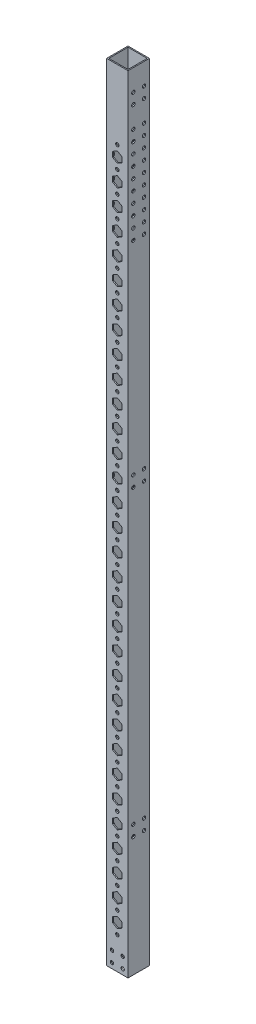
from build123d import *

# Parameters (mm, degrees)
SKETCH_1_W          = 20
SKETCH_1_H          = 20
SKETCH_1_W_2        = 18
SKETCH_1_H_2        = 18
EXTRUDE_1_DEPTH     = 735
SKETCH_4_R          = 1.6
CUT_EXTRUDE_2_DEPTH = 736.340057388
SKETCH_5_R          = 1.6
CUT_EXTRUDE_3_DEPTH = 736.340057388


with BuildPart() as part:
    # 草图1 → 拉伸-薄壁1 (new body)
    with BuildSketch(Plane(origin=(0, 0, 0), x_dir=(1, 0, 0), z_dir=(0, 1, 0))):
        Rectangle(SKETCH_1_W, SKETCH_1_H)
        Rectangle(SKETCH_1_W_2, SKETCH_1_H_2, mode=Mode.SUBTRACT)
    extrude(amount=EXTRUDE_1_DEPTH)

    # 草图4 → 切除-拉伸2 (cut, through all)
    with BuildSketch(Plane.XY.offset(10)):
        with Locations((0, 30)):
            Circle(SKETCH_4_R)
        with Locations((0, 50)):
            Circle(SKETCH_4_R)
        with Locations((0, 70)):
            Circle(SKETCH_4_R)
        with Locations((0, 90)):
            Circle(SKETCH_4_R)
        with Locations((0, 110)):
            Circle(SKETCH_4_R)
        with Locations((0, 130)):
            Circle(SKETCH_4_R)
        with Locations((0, 150)):
            Circle(SKETCH_4_R)
        with Locations((0, 170)):
            Circle(SKETCH_4_R)
        with Locations((0, 190)):
            Circle(SKETCH_4_R)
        with Locations((0, 210)):
            Circle(SKETCH_4_R)
        with Locations((0, 230)):
            Circle(SKETCH_4_R)
        with Locations((0, 250)):
            Circle(SKETCH_4_R)
        with Locations((0, 270)):
            Circle(SKETCH_4_R)
        with Locations((0, 290)):
            Circle(SKETCH_4_R)
        with Locations((0, 310)):
            Circle(SKETCH_4_R)
        with Locations((0, 330)):
            Circle(SKETCH_4_R)
        with Locations((0, 350)):
            Circle(SKETCH_4_R)
        with Locations((0, 370)):
            Circle(SKETCH_4_R)
        with Locations((0, 390)):
            Circle(SKETCH_4_R)
        with Locations((0, 410)):
            Circle(SKETCH_4_R)
        with Locations((0, 430)):
            Circle(SKETCH_4_R)
        with Locations((0, 450)):
            Circle(SKETCH_4_R)
        with Locations((0, 470)):
            Circle(SKETCH_4_R)
        with Locations((0, 490)):
            Circle(SKETCH_4_R)
        with Locations((0, 510)):
            Circle(SKETCH_4_R)
        with Locations((0, 530)):
            Circle(SKETCH_4_R)
        with Locations((0, 550)):
            Circle(SKETCH_4_R)
        with Locations((0, 570)):
            Circle(SKETCH_4_R)
        with Locations((0, 590)):
            Circle(SKETCH_4_R)
        with Locations((0, 610)):
            Circle(SKETCH_4_R)
        with Locations((0, 630)):
            Circle(SKETCH_4_R)
        with Locations((0, 650)):
            Circle(SKETCH_4_R)
        with Locations((0, 670)):
            Circle(SKETCH_4_R)
        with Locations((5, 5)):
            Circle(SKETCH_4_R)
        with Locations(Location((-5, 5, 0), (0, 0, 180))):
            Circle(SKETCH_4_R)
        with Locations((-5, 15)):
            Circle(SKETCH_4_R)
        with Locations(Location((5, 15, 0), (0, 0, 180))):
            Circle(SKETCH_4_R)
        Polygon((4.330127019, 62.5), (0, 65), (-4.330127019, 62.5), (-4.330127019, 57.5), (0, 55), (4.330127019, 57.5), align=None)
        Polygon((0, 45), (-4.330127019, 42.5), (-4.330127019, 37.5), (0, 35), (4.330127019, 37.5), (4.330127019, 42.5), align=None)
        Polygon((4.330127019, 82.5), (0, 85), (-4.330127019, 82.5), (-4.330127019, 77.5), (0, 75), (4.330127019, 77.5), align=None)
        Polygon((4.330127019, 102.5), (0, 105), (-4.330127019, 102.5), (-4.330127019, 97.5), (0, 95), (4.330127019, 97.5), align=None)
        Polygon((4.330127019, 122.5), (0, 125), (-4.330127019, 122.5), (-4.330127019, 117.5), (0, 115), (4.330127019, 117.5), align=None)
        Polygon((4.330127019, 142.5), (0, 145), (-4.330127019, 142.5), (-4.330127019, 137.5), (0, 135), (4.330127019, 137.5), align=None)
        Polygon((4.330127019, 162.5), (0, 165), (-4.330127019, 162.5), (-4.330127019, 157.5), (0, 155), (4.330127019, 157.5), align=None)
        Polygon((4.330127019, 182.5), (0, 185), (-4.330127019, 182.5), (-4.330127019, 177.5), (0, 175), (4.330127019, 177.5), align=None)
        Polygon((4.330127019, 202.5), (0, 205), (-4.330127019, 202.5), (-4.330127019, 197.5), (0, 195), (4.330127019, 197.5), align=None)
        Polygon((4.330127019, 222.5), (0, 225), (-4.330127019, 222.5), (-4.330127019, 217.5), (0, 215), (4.330127019, 217.5), align=None)
        Polygon((4.330127019, 242.5), (0, 245), (-4.330127019, 242.5), (-4.330127019, 237.5), (0, 235), (4.330127019, 237.5), align=None)
        Polygon((4.330127019, 262.5), (0, 265), (-4.330127019, 262.5), (-4.330127019, 257.5), (0, 255), (4.330127019, 257.5), align=None)
        Polygon((4.330127019, 282.5), (0, 285), (-4.330127019, 282.5), (-4.330127019, 277.5), (0, 275), (4.330127019, 277.5), align=None)
        Polygon((4.330127019, 302.5), (0, 305), (-4.330127019, 302.5), (-4.330127019, 297.5), (0, 295), (4.330127019, 297.5), align=None)
        Polygon((4.330127019, 322.5), (0, 325), (-4.330127019, 322.5), (-4.330127019, 317.5), (0, 315), (4.330127019, 317.5), align=None)
        Polygon((4.330127019, 342.5), (0, 345), (-4.330127019, 342.5), (-4.330127019, 337.5), (0, 335), (4.330127019, 337.5), align=None)
        Polygon((4.330127019, 362.5), (0, 365), (-4.330127019, 362.5), (-4.330127019, 357.5), (0, 355), (4.330127019, 357.5), align=None)
        Polygon((4.330127019, 382.5), (0, 385), (-4.330127019, 382.5), (-4.330127019, 377.5), (0, 375), (4.330127019, 377.5), align=None)
        Polygon((4.330127019, 402.5), (0, 405), (-4.330127019, 402.5), (-4.330127019, 397.5), (0, 395), (4.330127019, 397.5), align=None)
        Polygon((4.330127019, 422.5), (0, 425), (-4.330127019, 422.5), (-4.330127019, 417.5), (0, 415), (4.330127019, 417.5), align=None)
        Polygon((4.330127019, 442.5), (0, 445), (-4.330127019, 442.5), (-4.330127019, 437.5), (0, 435), (4.330127019, 437.5), align=None)
        Polygon((4.330127019, 462.5), (0, 465), (-4.330127019, 462.5), (-4.330127019, 457.5), (0, 455), (4.330127019, 457.5), align=None)
        Polygon((4.330127019, 482.5), (0, 485), (-4.330127019, 482.5), (-4.330127019, 477.5), (0, 475), (4.330127019, 477.5), align=None)
        Polygon((4.330127019, 502.5), (0, 505), (-4.330127019, 502.5), (-4.330127019, 497.5), (0, 495), (4.330127019, 497.5), align=None)
        Polygon((4.330127019, 522.5), (0, 525), (-4.330127019, 522.5), (-4.330127019, 517.5), (0, 515), (4.330127019, 517.5), align=None)
        Polygon((4.330127019, 542.5), (0, 545), (-4.330127019, 542.5), (-4.330127019, 537.5), (0, 535), (4.330127019, 537.5), align=None)
        Polygon((4.330127019, 562.5), (0, 565), (-4.330127019, 562.5), (-4.330127019, 557.5), (0, 555), (4.330127019, 557.5), align=None)
        Polygon((4.330127019, 582.5), (0, 585), (-4.330127019, 582.5), (-4.330127019, 577.5), (0, 575), (4.330127019, 577.5), align=None)
        Polygon((4.330127019, 602.5), (0, 605), (-4.330127019, 602.5), (-4.330127019, 597.5), (0, 595), (4.330127019, 597.5), align=None)
        Polygon((4.330127019, 622.5), (0, 625), (-4.330127019, 622.5), (-4.330127019, 617.5), (0, 615), (4.330127019, 617.5), align=None)
        Polygon((4.330127019, 642.5), (0, 645), (-4.330127019, 642.5), (-4.330127019, 637.5), (0, 635), (4.330127019, 637.5), align=None)
        Polygon((4.330127019, 662.5), (0, 665), (-4.330127019, 662.5), (-4.330127019, 657.5), (0, 655), (4.330127019, 657.5), align=None)
    extrude(amount=-CUT_EXTRUDE_2_DEPTH, mode=Mode.SUBTRACT)

    # 草图5 → 切除-拉伸3 (cut, through all)
    with BuildSketch(Plane(origin=(10, 0, 0), x_dir=(0, 0, -1), z_dir=(1, 0, 0))):
        with Locations((-5, 715)):
            Circle(SKETCH_5_R)
        with Locations((5, 715)):
            Circle(SKETCH_5_R)
        with Locations((5, 705)):
            Circle(SKETCH_5_R)
        with Locations((-5, 705)):
            Circle(SKETCH_5_R)
        with Locations((-5, 112)):
            Circle(SKETCH_5_R)
        with Locations((5, 112)):
            Circle(SKETCH_5_R)
        with Locations((5, 122)):
            Circle(SKETCH_5_R)
        with Locations((-5, 122)):
            Circle(SKETCH_5_R)
        with Locations((-5, 395)):
            Circle(SKETCH_5_R)
        with Locations((5, 395)):
            Circle(SKETCH_5_R)
        with Locations((5, 405)):
            Circle(SKETCH_5_R)
        with Locations((-5, 405)):
            Circle(SKETCH_5_R)
        with Locations((-5, 645)):
            Circle(SKETCH_5_R)
        with Locations((5, 645)):
            Circle(SKETCH_5_R)
        with Locations((5, 635)):
            Circle(SKETCH_5_R)
        with Locations((-5, 635)):
            Circle(SKETCH_5_R)
        with Locations((-5, 625)):
            Circle(SKETCH_5_R)
        with Locations((5, 625)):
            Circle(SKETCH_5_R)
        with Locations((5, 615)):
            Circle(SKETCH_5_R)
        with Locations((-5, 615)):
            Circle(SKETCH_5_R)
        with Locations((-5, 605)):
            Circle(SKETCH_5_R)
        with Locations((5, 605)):
            Circle(SKETCH_5_R)
        with Locations((5, 595)):
            Circle(SKETCH_5_R)
        with Locations((-5, 595)):
            Circle(SKETCH_5_R)
        with Locations((-5, 685)):
            Circle(SKETCH_5_R)
        with Locations((5, 685)):
            Circle(SKETCH_5_R)
        with Locations((5, 675)):
            Circle(SKETCH_5_R)
        with Locations((-5, 675)):
            Circle(SKETCH_5_R)
        with Locations((-5, 665)):
            Circle(SKETCH_5_R)
        with Locations((5, 665)):
            Circle(SKETCH_5_R)
        with Locations((5, 655)):
            Circle(SKETCH_5_R)
        with Locations((-5, 655)):
            Circle(SKETCH_5_R)
    extrude(amount=-CUT_EXTRUDE_3_DEPTH, mode=Mode.SUBTRACT)


solid = part.part
